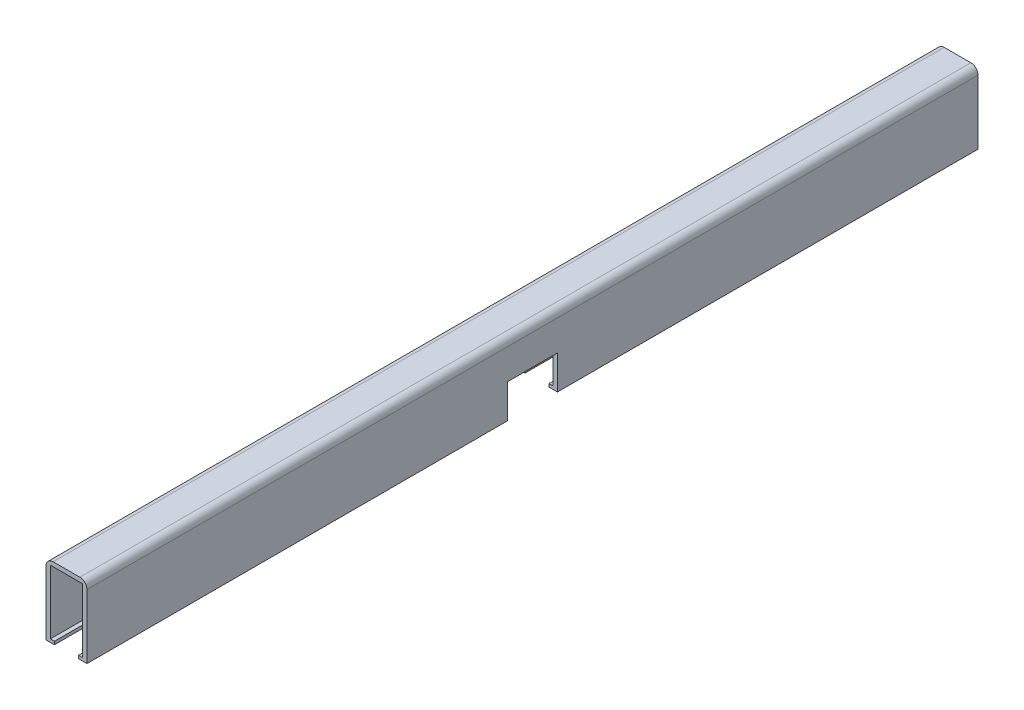
from build123d import *

# Parameters (mm, degrees)
BOSS_EXTRUDE1_DEPTH            = 250
CUT_EXTRUDE1_REACH             = 255.441
SKETCH2_W                      = 28
SKETCH2_H                      = 19
CUT_EXTRUDE1_DIRECTION_2_REACH = 255.441


with BuildPart() as part:
    # Sketch1 → Boss-Extrude1 (new, symmetric)
    with BuildSketch(Plane.XY):
        with BuildLine():
            Line((6.785, 0), (6.785, 1.73))
            Line((6.785, 1.73), (9.07, 1.73))
            Line((9.07, 1.73), (9.07, 37.58))
            Line((9.07, 37.58), (-9.07, 37.58))
            Line((-9.07, 37.58), (-9.07, 1.73))
            Line((-9.07, 1.73), (-6.785, 1.73))
            Line((-6.785, 1.73), (-6.785, 0))
            Line((-6.785, 0), (-11.5, 0))
            Line((-11.5, 0), (-11.5, 36))
            ThreePointArc((-11.5, 36), (-10.328427125, 38.828427125), (-7.5, 40))
            Line((-7.5, 40), (7.5, 40))
            ThreePointArc((7.5, 40), (10.328427125, 38.828427125), (11.5, 36))
            Line((11.5, 36), (11.5, 0))
            Line((11.5, 0), (6.785, 0))
        make_face()
    extrude(amount=BOSS_EXTRUDE1_DEPTH, both=True)

    # Sketch2 → Cut-Extrude1 (cut, up to next)
    with BuildSketch(Plane(origin=(0, 0, 0), x_dir=(0, 0, -1), z_dir=(1, 0, 0)), mode=Mode.PRIVATE) as cut_extrude1_sk1:
        with Locations((0, 9.5)):
            Rectangle(SKETCH2_W, SKETCH2_H)
    cut_extrude1_tool1 = extrude(cut_extrude1_sk1.sketch, amount=-CUT_EXTRUDE1_REACH, mode=Mode.PRIVATE) & part.part
    add(cut_extrude1_tool1.solids().sort_by_distance((0, 9.5, 0))[0], mode=Mode.SUBTRACT)

    # Sketch2 → Cut-Extrude1 direction 2 (cut, up to next)
    with BuildSketch(Plane(origin=(0, 0, 0), x_dir=(0, 0, -1), z_dir=(1, 0, 0)), mode=Mode.PRIVATE) as cut_extrude1_direction_2_sk1:
        with Locations((0, 9.5)):
            Rectangle(SKETCH2_W, SKETCH2_H)
    cut_extrude1_direction_2_tool1 = extrude(cut_extrude1_direction_2_sk1.sketch, amount=CUT_EXTRUDE1_DIRECTION_2_REACH, mode=Mode.PRIVATE) & part.part
    add(cut_extrude1_direction_2_tool1.solids().sort_by_distance((0, 9.5, 0))[0], mode=Mode.SUBTRACT)


solid = part.part
